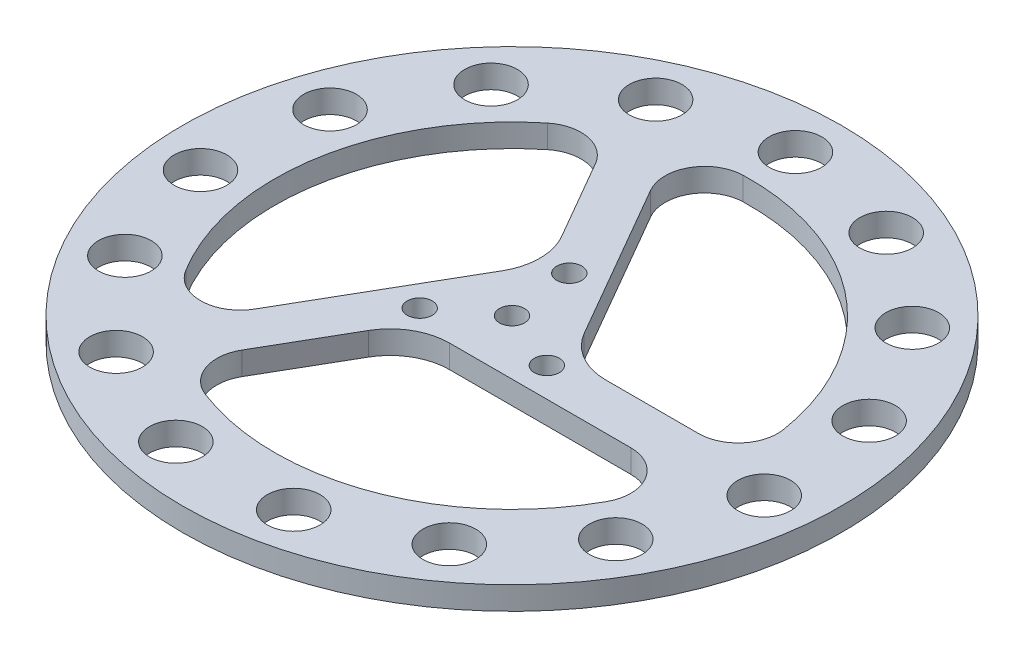
from build123d import *

# Parameters (mm, degrees)
SKETCH1_R           = 50
SKETCH1_R_2         = 1.9
BOSS_EXTRUDE1_DEPTH = 3.5
SKETCH2_R           = 4
CUT_EXTRUDE1_DEPTH  = 3.5
CIRPATTERN1_COUNT   = 15
CUT_EXTRUDE5_DEPTH  = 10
CIRPATTERN3_COUNT   = 3
SKETCH4_R           = 1.9
CUT_EXTRUDE6_DEPTH  = 3.5


with BuildPart() as part:
    # Sketch1 → Boss-Extrude1 (new body)
    with BuildSketch(Plane(origin=(0, 0, 0), x_dir=(1, 0, 0), z_dir=(0, 1, 0))):
        with Locations(Location((0, 0, 0), (0, 0, 270))):
            Circle(SKETCH1_R)
        with Locations(Location((0, 0, 0), (0, 0, 270))):
            Circle(SKETCH1_R_2, mode=Mode.SUBTRACT)
    extrude(amount=BOSS_EXTRUDE1_DEPTH)

    # Sketch2 → Cut-Extrude1 (cut)
    with BuildSketch(Plane(origin=(0, 3.5, 0), x_dir=(1, 0, 0), z_dir=(0, 1, 0))):
        with Locations(Location((0, 43, 0), (0, 0, 270))):
            Circle(SKETCH2_R)
    cut_extrude1 = extrude(amount=-CUT_EXTRUDE1_DEPTH, mode=Mode.SUBTRACT)

    # CirPattern1: Cut-Extrude1 ×15 about axis
    cirpattern1_axis = Axis((0, 0, 0), (0, 1, 0))
    for i in range(1, CIRPATTERN1_COUNT):
        add(cut_extrude1.rotate(cirpattern1_axis, i * 360 / CIRPATTERN1_COUNT), mode=Mode.SUBTRACT)

    # Sketch3 → Cut-Extrude5 (cut)
    with BuildSketch(Plane(origin=(0, 3.5, 0), x_dir=(1, 0, 0), z_dir=(0, 1, 0))):
        with BuildLine():
            ThreePointArc((7.794228634, 3.166666667), (11.088457268, -0.127561967), (15.588457268, -1.333333333))
            Line((15.588457268, -1.333333333), (29.634814361, -1.333333333))
            ThreePointArc((29.634814361, -1.333333333), (34.195516062, 0.767948929), (35.561777233, 5.6))
            ThreePointArc((35.561777233, 5.6), (23.0418607, 27.659946773), (-0.917016216, 35.988318678))
            ThreePointArc((-0.917016216, 35.988318678), (-5.998123181, 32.92383688), (-5.960332603, 26.990265565))
            Line((-5.960332603, 26.990265565), (0, 16.666666667))
            Line((0, 16.666666667), (7.794228634, 3.166666667))
        make_face()
    cut_extrude5 = extrude(amount=-CUT_EXTRUDE5_DEPTH, mode=Mode.SUBTRACT)

    # CirPattern3: Cut-Extrude5 ×3 about axis
    cirpattern3_axis = Axis((0, 0, 0), (0, 1, 0))
    for i in range(1, CIRPATTERN3_COUNT):
        add(cut_extrude5.rotate(cirpattern3_axis, i * 360 / CIRPATTERN3_COUNT), mode=Mode.SUBTRACT)

    # Sketch4 → Cut-Extrude6 (cut)
    with BuildSketch(Plane(origin=(0, 0, 0), x_dir=(1, 0, 0), z_dir=(0, 1, 0))):
        with Locations(Location((-1.230688491, 9.92398135, 0), (0, 0, 90))):
            Circle(SKETCH4_R)
        with Locations(Location((9.18308139, -3.899170456, 0), (0, 0, 90))):
            Circle(SKETCH4_R)
        with Locations(Location((-7.995004175, -6.006183819, 0), (0, 0, 90))):
            Circle(SKETCH4_R)
    extrude(amount=CUT_EXTRUDE6_DEPTH, mode=Mode.SUBTRACT)


solid = part.part
